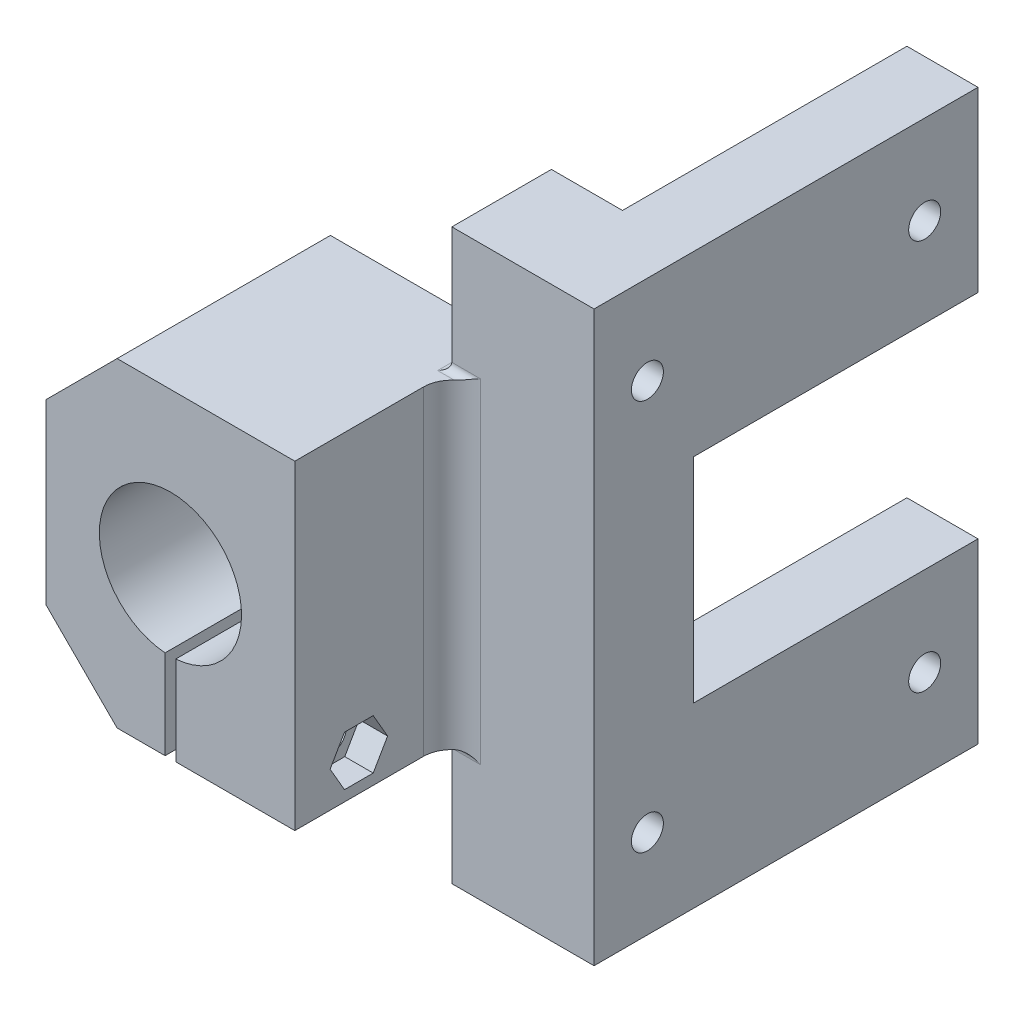
from build123d import *

# Parameters (mm, degrees)
SKETCH1_W                                         = 35
SKETCH1_H                                         = 45
SKETCH1_R                                         = 10
BOSS_EXTRUDE1_DEPTH                               = 30
SKETCH2_W                                         = 54
SKETCH2_H                                         = 80
SKETCH2_R                                         = 2.25
BOSS_EXTRUDE2_DEPTH                               = 20
SKETCH3_W                                         = 40
SKETCH3_H                                         = 80
CUT_EXTRUDE1_DEPTH                                = 10
SKETCH5_W                                         = 40
SKETCH5_H                                         = 30
CUT_EXTRUDE2_DEPTH                                = 10
FILLET1_R                                         = 4
FILLET2_R                                         = 1
CHAMFER1_SIZE                                     = 10
CUT_EXTRUDE3_DEPTH                                = 4
SKETCH11_R                                        = 4
CUT_EXTRUDE4_DEPTH                                = 76.818013919
CUT_EXTRUDE5_DEPTH                                = 94.778592345
CHAMBRAGE_POUR_VIS_SIX_PANS_CREUX_M42_D           = 4.5
CHAMBRAGE_POUR_VIS_SIX_PANS_CREUX_M42_CBORE_D     = 8
CHAMBRAGE_POUR_VIS_SIX_PANS_CREUX_M42_CBORE_DEPTH = 4.4
CHAMBRAGE_POUR_VIS_SIX_PANS_CREUX_M43_D           = 4.5
CHAMBRAGE_POUR_VIS_SIX_PANS_CREUX_M43_CBORE_D     = 8
CHAMBRAGE_POUR_VIS_SIX_PANS_CREUX_M43_CBORE_DEPTH = 4.4


with BuildPart() as part:
    # Sketch1 → Boss-Extrude1 (new body)
    with BuildSketch(Plane.XY):
        Rectangle(SKETCH1_W, SKETCH1_H)
        Circle(SKETCH1_R, mode=Mode.SUBTRACT)
    extrude(amount=BOSS_EXTRUDE1_DEPTH)

    # Sketch2 → Boss-Extrude2 (add)
    with BuildSketch(Plane(origin=(17.5, 0, 0), x_dir=(0, 0, -1), z_dir=(1, 0, 0))):
        with Locations((19.080052459, 0)):
            Rectangle(SKETCH2_W, SKETCH2_H)
        with Locations((-0.419947541, 27.5)):
            Circle(SKETCH2_R, mode=Mode.SUBTRACT)
        with Locations((38.580052459, 27.5)):
            Circle(SKETCH2_R, mode=Mode.SUBTRACT)
        with Locations((38.580052459, -27.5)):
            Circle(SKETCH2_R, mode=Mode.SUBTRACT)
        with Locations((-0.419947541, -27.5)):
            Circle(SKETCH2_R, mode=Mode.SUBTRACT)
    extrude(amount=BOSS_EXTRUDE2_DEPTH)

    # Sketch3 → Cut-Extrude1 (cut)
    with BuildSketch(Plane.ZY.offset(-17.5)):
        with Locations((-26.080052459, 0)):
            Rectangle(SKETCH3_W, SKETCH3_H)
    extrude(amount=-CUT_EXTRUDE1_DEPTH, mode=Mode.SUBTRACT)

    # Sketch5 → Cut-Extrude2 (cut)
    with BuildSketch(Plane(origin=(37.5, 0, 0), x_dir=(0, 0, -1), z_dir=(1, 0, 0))):
        with Locations((26.080052459, 0)):
            Rectangle(SKETCH5_W, SKETCH5_H)
    extrude(amount=-CUT_EXTRUDE2_DEPTH, mode=Mode.SUBTRACT)

    # Fillet1
    fillet1_edges = [part.edges().sort_by_distance(p)[0] for p in [
        (17.5, 0, 7.919947541),
        (17.5, 0, 0),
    ]]
    fillet(fillet1_edges, radius=FILLET1_R)

    # Fillet2
    fillet2_edges = [part.edges().sort_by_distance(p)[0] for p in [
        (17.5, 22.5, 1.95997377),
        (17.5, -22.5, 1.95997377),
        (19.5, 22.5, 7.919947541),
        (19.5, -22.5, 7.919947541),
    ]]
    fillet(fillet2_edges, radius=FILLET2_R)

    # Chamfer1
    chamfer1_edges = [part.edges().sort_by_distance(p)[0] for p in [
        (-17.5, 22.5, 15),
        (-17.5, -22.5, 15),
    ]]
    chamfer(chamfer1_edges, length=CHAMFER1_SIZE)

    # Sketch6 → Cut-Extrude3 (cut)
    with BuildSketch(Plane(origin=(17.5, 0, 0), x_dir=(0, 0, -1), z_dir=(1, 0, 0))):
        Polygon((-18.979274058, -21), (-16.958548116, -17.5), (-18.979274058, -14), (-23.020725942, -14), (-25.041451884, -17.5), (-23.020725942, -21), align=None)
    extrude(amount=-CUT_EXTRUDE3_DEPTH, mode=Mode.SUBTRACT)

    # Sketch10 → Chambrage pour vis à six pans creux M41 (revolve, cut)
    with BuildSketch(Plane(origin=(-7.5, -17.5, 21), x_dir=(0, 0, 1), z_dir=(0, 1, 0))):
        Polygon((0, 0), (0, 45), (2.25, 45), (2.25, 4.4), (4, 4.4), (4, 0), align=None)
    revolve(axis=Axis((-13.85, -17.5, 21), (1, 0, 0)), mode=Mode.SUBTRACT)

    # Sketch11 → Cut-Extrude4 (cut, through all)
    with BuildSketch(Plane(origin=(-7.5, 0, 0), x_dir=(0, 0, -1), z_dir=(1, 0, 0))):
        with Locations(Location((-21, -17.5, 0), (0, 0, 180))):
            Circle(SKETCH11_R)
    extrude(amount=-CUT_EXTRUDE4_DEPTH, mode=Mode.SUBTRACT)

    # Sketch12 → Cut-Extrude5 (cut, through all)
    with BuildSketch(Plane.XY.offset(30)):
        with BuildLine():
            Line((0.75, -9.971835338), (0.75, -31.545013405))
            Line((0.75, -31.545013405), (-0.75, -31.545013405))
            Line((-0.75, -31.545013405), (-0.75, -9.971835338))
            ThreePointArc((-0.75, -9.971835338), (0, -10), (0.75, -9.971835338))
        make_face()
    extrude(amount=-CUT_EXTRUDE5_DEPTH, mode=Mode.SUBTRACT)

    # Chambrage pour vis à six pans creux M42 (through all)
    with Locations(Plane.ZY.offset(-17.5)):
        with Locations((0.419947541, -27.5), (0.419947541, 27.5)):
            CounterBoreHole(CHAMBRAGE_POUR_VIS_SIX_PANS_CREUX_M42_D / 2, CHAMBRAGE_POUR_VIS_SIX_PANS_CREUX_M42_CBORE_D / 2, CHAMBRAGE_POUR_VIS_SIX_PANS_CREUX_M42_CBORE_DEPTH)

    # Chambrage pour vis à six pans creux M43 (through all)
    with Locations(Plane.ZY.offset(-27.5)):
        with Locations((-38.580052459, 27.5), (-38.580052459, -27.5)):
            CounterBoreHole(CHAMBRAGE_POUR_VIS_SIX_PANS_CREUX_M43_D / 2, CHAMBRAGE_POUR_VIS_SIX_PANS_CREUX_M43_CBORE_D / 2, CHAMBRAGE_POUR_VIS_SIX_PANS_CREUX_M43_CBORE_DEPTH)


solid = part.part
